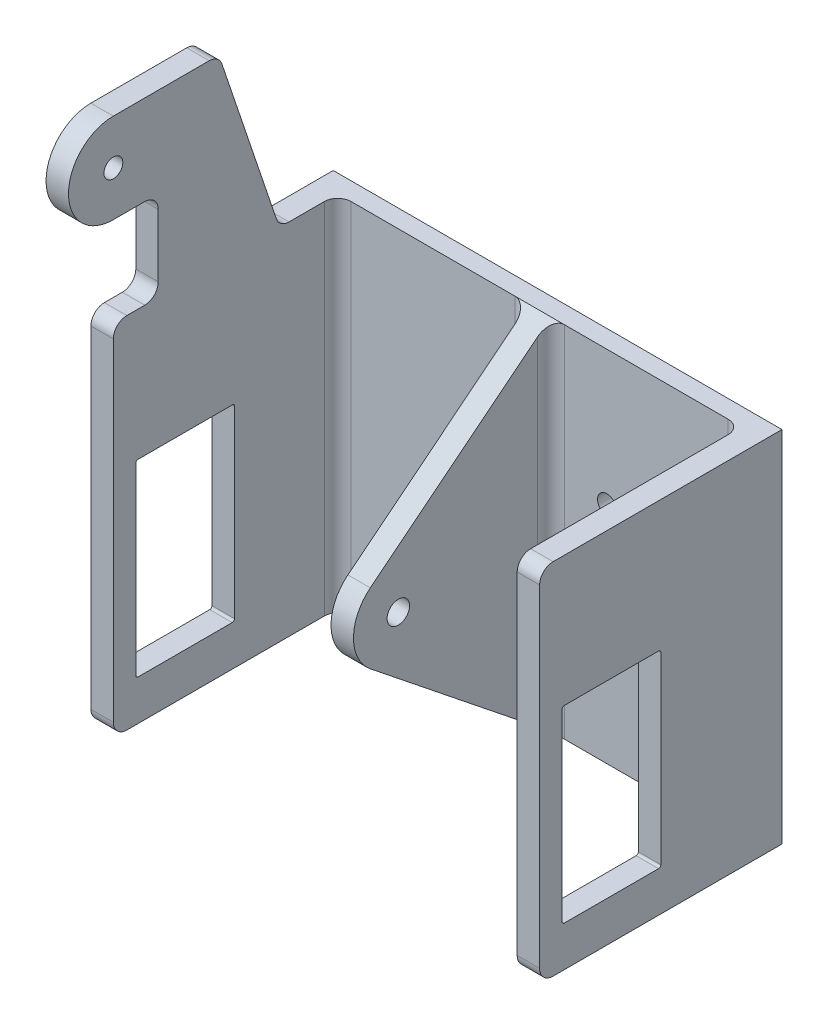
from build123d import *

# Parameters (mm, degrees)
SKETCH_1_W          = 100
SKETCH_1_H          = 80
EXTRUDE_1_DEPTH     = 4
SKETCH_2_W          = 5
SKETCH_2_H          = 80
EXTRUDE_2_DEPTH     = 50
CUT_EXTRUDE_2_DEPTH = 5
FILLET_1_R          = 10
FILLET_2_R          = 3
FILLET_3_R          = 3
SKETCH_5_R          = 2.1
CUT_EXTRUDE_3_DEPTH = 5
SKETCH_6_R          = 2.5
CUT_EXTRUDE_4_DEPTH = 10
SKETCH_7_W          = 22
SKETCH_7_H          = 42
CUT_EXTRUDE_5_DEPTH = 10
SKETCH_8_W          = 22
SKETCH_8_H          = 42
CUT_EXTRUDE_6_DEPTH = 10
FILLET_4_R          = 0.5
FILLET_5_R          = 0.5
SKETCH_9_W          = 5
SKETCH_9_H          = 27
EXTRUDE_3_DEPTH     = 40
CUT_EXTRUDE_7_DEPTH = 20
SKETCH_11_W         = 5
SKETCH_11_H         = 20
EXTRUDE_4_DEPTH     = 20
FILLET_6_RADIUS     = 10
FILLET_6_LENGTH     = 5
FILLET_7_R          = 3
SKETCH_12_R         = 2.1
CUT_EXTRUDE_8_DEPTH = 20


with BuildPart() as part:
    # 草图1 → 凸台-拉伸1 (new body)
    with BuildSketch(Plane.XY):
        with Locations((50, 40)):
            Rectangle(SKETCH_1_W, SKETCH_1_H)
    extrude(amount=EXTRUDE_1_DEPTH)

    # 草图2 → 凸台-拉伸2 (add)
    with BuildSketch(Plane.XY.offset(4)):
        with Locations((2.5, 40)):
            Rectangle(SKETCH_2_W, SKETCH_2_H)
        with Locations((97.5, 40)):
            Rectangle(SKETCH_2_W, SKETCH_2_H)
        with Locations((50, 40)):
            Rectangle(SKETCH_2_W, SKETCH_2_H)
    extrude(amount=EXTRUDE_2_DEPTH)

    # 草图4 → 切除-拉伸2 (cut)
    with BuildSketch(Plane.ZY.offset(-47.5)):
        Polygon((54, 80), (4, 80), (54, 40), align=None)
        Polygon((54, 0), (54, 40), (4, 0), align=None)
    extrude(amount=-CUT_EXTRUDE_2_DEPTH, mode=Mode.SUBTRACT)

    # 圆角1
    fillet_1_edges = [part.edges().sort_by_distance(p)[0] for p in [
        (50, 40, 54),
    ]]
    fillet(fillet_1_edges, radius=FILLET_1_R)

    # 圆角2
    fillet_2_edges = [part.edges().sort_by_distance(p)[0] for p in [
        (5, 40, 4),
        (2.5, 0, 54),
        (2.5, 80, 54),
        (95, 40, 4),
        (97.5, 80, 54),
        (97.5, 0, 54),
    ]]
    fillet(fillet_2_edges, radius=FILLET_2_R)

    # 圆角3
    fillet_3_edges = [part.edges().sort_by_distance(p)[0] for p in [
        (47.5, 40, 4),
        (52.5, 40, 4),
    ]]
    fillet(fillet_3_edges, radius=FILLET_3_R)

    # 草图5 → 切除-拉伸3 (cut)
    with BuildSketch(Plane(origin=(0, 0, 0), x_dir=(-1, 0, 0), z_dir=(0, 0, -1))):
        with Locations((-65, 50)):
            Circle(SKETCH_5_R)
        with Locations((-35, 50)):
            Circle(SKETCH_5_R)
        with Locations((-65, 30)):
            Circle(SKETCH_5_R)
        with Locations((-35, 30)):
            Circle(SKETCH_5_R)
    extrude(amount=-CUT_EXTRUDE_3_DEPTH, mode=Mode.SUBTRACT)

    # 草图6 → 切除-拉伸4 (cut)
    with BuildSketch(Plane.ZY.offset(-47.5)):
        with Locations(Location((37.992189406, 40, 0), (0, 0, 270))):
            Circle(SKETCH_6_R)
    extrude(amount=-CUT_EXTRUDE_4_DEPTH, mode=Mode.SUBTRACT)

    # 草图7 → 切除-拉伸5 (cut)
    with BuildSketch(Plane.ZY):
        with Locations((38, 30)):
            Rectangle(SKETCH_7_W, SKETCH_7_H)
    extrude(amount=-CUT_EXTRUDE_5_DEPTH, mode=Mode.SUBTRACT)

    # 草图8 → 切除-拉伸6 (cut)
    with BuildSketch(Plane(origin=(100, 0, 0), x_dir=(0, 0, -1), z_dir=(1, 0, 0))):
        with Locations((-38, 30)):
            Rectangle(SKETCH_8_W, SKETCH_8_H)
    extrude(amount=-CUT_EXTRUDE_6_DEPTH, mode=Mode.SUBTRACT)

    # 圆角4
    fillet_4_edges = [part.edges().sort_by_distance(p)[0] for p in [
        (97.5, 9, 49),
        (97.5, 51, 49),
        (97.5, 51, 27),
        (97.5, 9, 27),
    ]]
    fillet(fillet_4_edges, radius=FILLET_4_R)

    # 圆角5
    fillet_5_edges = [part.edges().sort_by_distance(p)[0] for p in [
        (2.5, 9, 27),
        (2.5, 51, 27),
        (2.5, 51, 49),
        (2.5, 9, 49),
    ]]
    fillet(fillet_5_edges, radius=FILLET_5_R)

    # 草图9 → 凸台-拉伸3 (add)
    with BuildSketch(Plane(origin=(0, 80, 0), x_dir=(1, 0, 0), z_dir=(0, 1, 0))):
        with Locations((2.5, -30.5)):
            Rectangle(SKETCH_9_W, SKETCH_9_H)
    extrude(amount=EXTRUDE_3_DEPTH)

    # 草图10 → 切除-拉伸7 (cut)
    with BuildSketch(Plane.ZY):
        Polygon((17, 80), (30.5, 120), (17, 120), align=None)
    extrude(amount=-CUT_EXTRUDE_7_DEPTH, mode=Mode.SUBTRACT)

    # 草图11 → 凸台-拉伸4 (add)
    with BuildSketch(Plane.XY.offset(44)):
        with Locations((2.5, 110)):
            Rectangle(SKETCH_11_W, SKETCH_11_H)
    extrude(amount=EXTRUDE_4_DEPTH)

    # 圆角6: full round fillet: the end face becomes a half cylinder, R = half its width
    fillet_6_face = Plane((2.5, 110, 64), x_dir=(1, 0, 0), z_dir=(0, 0, 1))  # on the end face: x along it, z out of the body
    fillet_6_slab = fillet_6_face.offset(-FILLET_6_RADIUS / 2) * Box(FILLET_6_LENGTH, 2 * FILLET_6_RADIUS, FILLET_6_RADIUS, mode=Mode.PRIVATE)  # the body's end, R deep
    fillet_6_round = Plane((2.5, 110, 54), x_dir=(0, 0, 1), z_dir=(1, 0, 0)) * Cylinder(FILLET_6_RADIUS, FILLET_6_LENGTH, mode=Mode.PRIVATE)  # its axis R under the face
    add(fillet_6_slab - fillet_6_round, mode=Mode.SUBTRACT)

    # 圆角7
    fillet_7_edges = [part.edges().sort_by_distance(p)[0] for p in [
        (2.5, 80, 44),
        (2.5, 80, 17),
        (2.5, 120, 30.5),
        (2.5, 100, 44),
    ]]
    fillet(fillet_7_edges, radius=FILLET_7_R)

    # 草图12 → 切除-拉伸8 (cut)
    with BuildSketch(Plane.ZY):
        with Locations((54, 110)):
            Circle(SKETCH_12_R)
    extrude(amount=-CUT_EXTRUDE_8_DEPTH, mode=Mode.SUBTRACT)


solid = part.part
